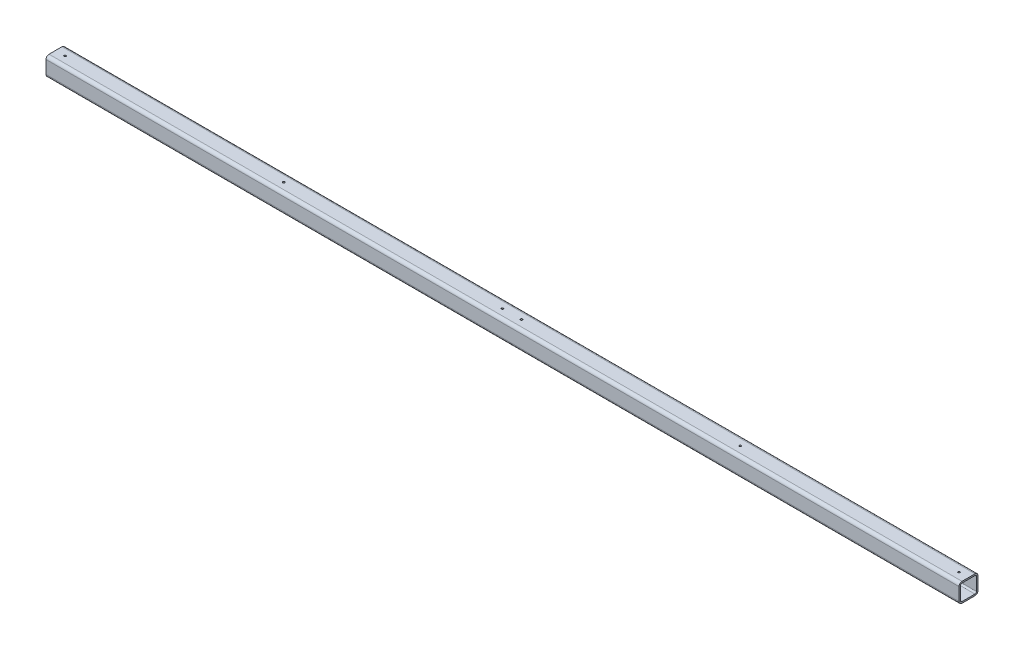
from build123d import *

# Parameters (mm, degrees)
TUBE_SQUARE_40_X_40_X_3_2_4_DEPTH = 1920
SKETCH13_R                        = 2
CUT_EXTRUDE1_DEPTH                = 3


with BuildPart() as part:
    # Sketch12 → Tube (square) 40 X 40 X 3.2(4) (new body)
    with BuildSketch(Plane(origin=(0, 0, 0), x_dir=(0, 0, -1), z_dir=(1, 0, 0))):
        with BuildLine():
            Line((-13.6, -20), (13.6, -20))
            ThreePointArc((13.6, -20), (18.1254834, -18.1254834), (20, -13.6))
            Line((20, -13.6), (20, 13.6))
            ThreePointArc((20, 13.6), (18.1254834, 18.1254834), (13.6, 20))
            Line((13.6, 20), (-13.6, 20))
            ThreePointArc((-13.6, 20), (-18.1254834, 18.1254834), (-20, 13.6))
            Line((-20, 13.6), (-20, -13.6))
            ThreePointArc((-20, -13.6), (-18.1254834, -18.1254834), (-13.6, -20))
        make_face()
        with BuildLine():
            Line((-13.6, -16.8), (13.6, -16.8))
            ThreePointArc((13.6, -16.8), (15.8627417, -15.8627417), (16.8, -13.6))
            Line((16.8, -13.6), (16.8, 13.6))
            ThreePointArc((16.8, 13.6), (15.8627417, 15.8627417), (13.6, 16.8))
            Line((13.6, 16.8), (-13.6, 16.8))
            ThreePointArc((-13.6, 16.8), (-15.8627417, 15.8627417), (-16.8, 13.6))
            Line((-16.8, 13.6), (-16.8, -13.6))
            ThreePointArc((-16.8, -13.6), (-15.8627417, -15.8627417), (-13.6, -16.8))
        make_face(mode=Mode.SUBTRACT)
    extrude(amount=TUBE_SQUARE_40_X_40_X_3_2_4_DEPTH)

    # Sketch13 → Cut-Extrude1 (cut)
    with BuildSketch(Plane(origin=(0, 20, 0), x_dir=(1, 0, 0), z_dir=(0, 1, 0))):
        with Locations(Location((20, 0, 0), (0, 0, 270))):
            Circle(SKETCH13_R)
        with Locations(Location((1900, 0, 0), (0, 0, 270))):
            Circle(SKETCH13_R)
        with Locations(Location((980, 0, 0), (0, 0, 270))):
            Circle(SKETCH13_R)
        with Locations(Location((940, 0, 0), (0, 0, 270))):
            Circle(SKETCH13_R)
        with Locations(Location((1440, 0, 0), (0, 0, 270))):
            Circle(SKETCH13_R)
        with Locations(Location((480, 0, 0), (0, 0, 270))):
            Circle(SKETCH13_R)
    extrude(amount=-CUT_EXTRUDE1_DEPTH, mode=Mode.SUBTRACT)


solid = part.part
